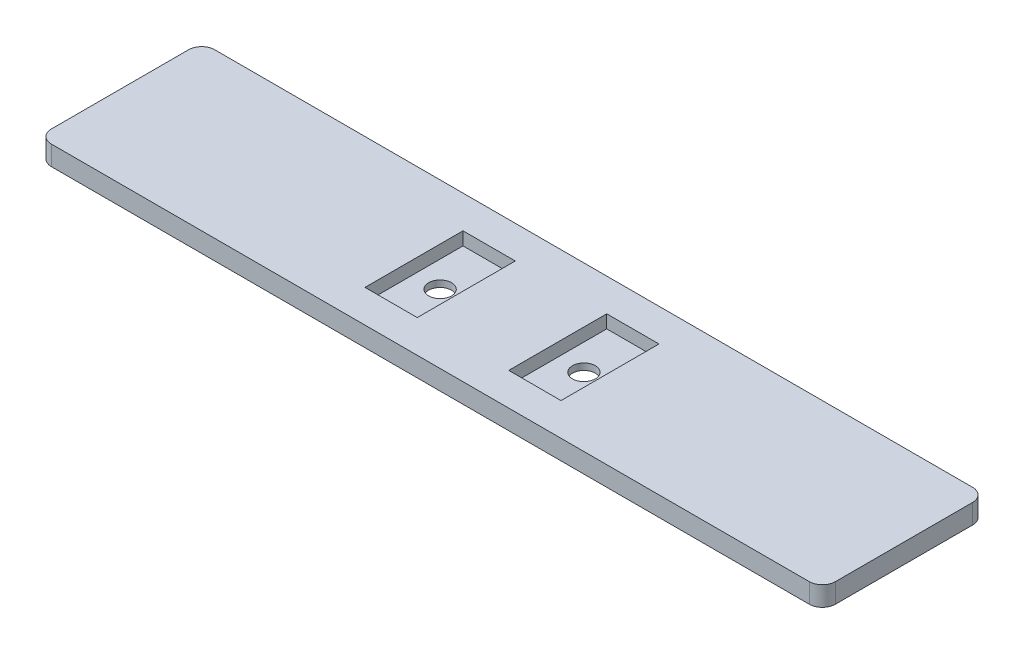
from build123d import *

# Parameters (mm, degrees)
TOP_COVER_W         = 120
TOP_COVER_H         = 25
BOSS_EXTRUDE1_DEPTH = 3
ATTACHMENT_POINT_W  = 8
ATTACHMENT_POINT_H  = 15
CUT_EXTRUDE1_DEPTH  = 2
SKETCH4_R           = 1.75
M3_SCREW_CUT_DEPTH  = 62.361632964
FILLET1_R           = 2
FILLET2_R           = 2
FILLET3_R           = 2
FILLET4_R           = 2


with BuildPart() as part:
    # Top Cover → Boss-Extrude1 (new body)
    with BuildSketch(Plane(origin=(0, 0, 0), x_dir=(1, 0, 0), z_dir=(0, 1, 0))):
        Rectangle(TOP_COVER_W, TOP_COVER_H)
    extrude(amount=BOSS_EXTRUDE1_DEPTH)

    # Attachment Point → Cut-Extrude1 (cut)
    with BuildSketch(Plane(origin=(0, 3, 0), x_dir=(1, 0, 0), z_dir=(0, 1, 0))):
        with Locations((-11, 0)):
            Rectangle(ATTACHMENT_POINT_W, ATTACHMENT_POINT_H)
        with Locations((11, 0)):
            Rectangle(ATTACHMENT_POINT_W, ATTACHMENT_POINT_H)
    extrude(amount=-CUT_EXTRUDE1_DEPTH, mode=Mode.SUBTRACT)

    # Sketch4 → M3 Screw CUT (cut, through all)
    with BuildSketch(Plane(origin=(0, 3, 0), x_dir=(1, 0, 0), z_dir=(0, 1, 0))):
        with Locations(Location((-11, 0, 0), (0, 0, 270))):
            Circle(SKETCH4_R)
        with Locations(Location((11, 0, 0), (0, 0, 90))):
            Circle(SKETCH4_R)
    extrude(amount=-M3_SCREW_CUT_DEPTH, mode=Mode.SUBTRACT)

    # Fillet1
    fillet1_edges = [part.edges().sort_by_distance(p)[0] for p in [
        (-60, 1.5, 12.5),
    ]]
    fillet(fillet1_edges, radius=FILLET1_R)

    # Fillet2
    fillet2_edges = [part.edges().sort_by_distance(p)[0] for p in [
        (60, 1.5, 12.5),
    ]]
    fillet(fillet2_edges, radius=FILLET2_R)

    # Fillet3
    fillet3_edges = [part.edges().sort_by_distance(p)[0] for p in [
        (60, 1.5, -12.5),
    ]]
    fillet(fillet3_edges, radius=FILLET3_R)

    # Fillet4
    fillet4_edges = [part.edges().sort_by_distance(p)[0] for p in [
        (-60, 1.5, -12.5),
    ]]
    fillet(fillet4_edges, radius=FILLET4_R)


solid = part.part
